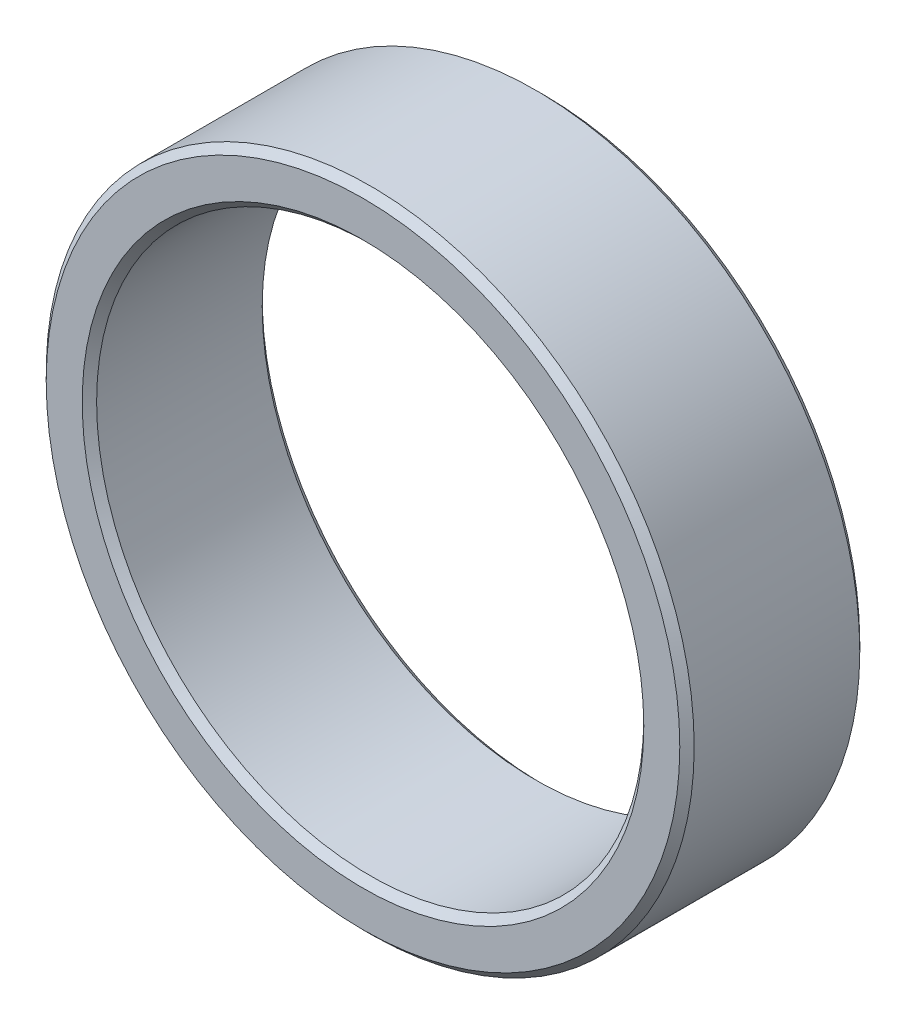
from build123d import *

# Parameters (mm, degrees)
SKETCH1_R           = 9
SKETCH1_R_2         = 7.6
BOSS_EXTRUDE1_DEPTH = 5
CHAMFER1_SIZE       = 0.2


with BuildPart() as part:
    # Sketch1 → Boss-Extrude1 (new body)
    with BuildSketch(Plane.XY):
        Circle(SKETCH1_R)
        Circle(SKETCH1_R_2, mode=Mode.SUBTRACT)
    extrude(amount=BOSS_EXTRUDE1_DEPTH)

    # Chamfer1
    chamfer1_edges = [part.edges().sort_by_distance(p)[0] for p in [
        (-9, 0, 0),
        (-9, 0, 5),
        (-7.6, 0, 0),
        (-7.6, 0, 5),
    ]]
    chamfer(chamfer1_edges, length=CHAMFER1_SIZE)


solid = part.part
